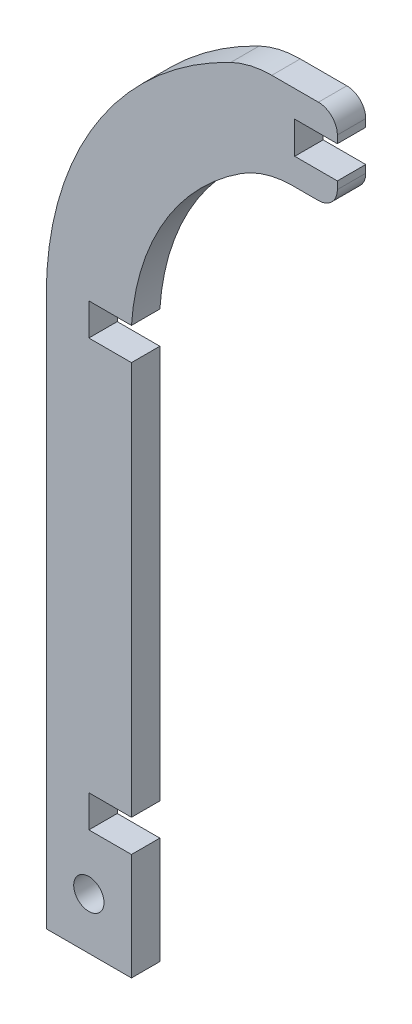
from build123d import *

# Parameters (mm, degrees)
BOSS_EXTRUDE1_DEPTH      = 1.5
M3_CLEARANCE_HOLE1_D     = 3.2
M3_CLEARANCE_HOLE1_DEPTH = 10
M3_CLEARANCE_HOLE1_TIP   = 0.96137699
FILLET1_R                = 2


with BuildPart() as part:
    # Sketch1 → Boss-Extrude1 (new, symmetric)
    with BuildSketch(Plane.XY):
        with BuildLine():
            Line((-54.5, 0), (-45.5, 0))
            Line((-45.5, 0), (-45.5, 11.3))
            Line((-45.5, 11.3), (-50, 11.3))
            Line((-50, 11.3), (-50, 14.7))
            Line((-50, 14.7), (-45.5, 14.7))
            Line((-45.5, 14.7), (-45.5, 56.3))
            Line((-45.5, 56.3), (-50, 56.3))
            Line((-50, 56.3), (-50, 59.7))
            Line((-50, 59.7), (-45.5, 59.7))
            ThreePointArc((-45.5, 59.7), (-42.033246866, 70.926263127), (-33.896614513, 79.402263071))
            ThreePointArc((-33.896614513, 79.402263071), (-31.300681808, 80.592252882), (-28.474255682, 81))
            Line((-28.474255682, 81), (-23.75, 81))
            Line((-23.75, 81), (-23.75, 83.8))
            Line((-23.75, 83.8), (-28.25, 83.8))
            Line((-28.25, 83.8), (-28.25, 87.2))
            Line((-28.25, 87.2), (-23.75, 87.2))
            Line((-23.75, 87.2), (-23.75, 90))
            Line((-23.75, 90), (-30.672661807, 90))
            ThreePointArc((-30.672661807, 90), (-32.89665693, 89.749556179), (-35.009254886, 89.010769138))
            ThreePointArc((-35.009254886, 89.010769138), (-49.222697481, 76.313635273), (-54.5, 58))
            Line((-54.5, 58), (-54.5, 0))
        make_face()
    extrude(amount=BOSS_EXTRUDE1_DEPTH, both=True)

    # M3 Clearance Hole1
    with Locations(Plane.XY.offset(1.5)):
        with Locations((-50, 5.4375)):
            Hole(M3_CLEARANCE_HOLE1_D / 2, depth=M3_CLEARANCE_HOLE1_DEPTH)
            with Locations((0, 0, -(M3_CLEARANCE_HOLE1_DEPTH + M3_CLEARANCE_HOLE1_TIP / 2))):  # 118° drill point
                Cone(0, M3_CLEARANCE_HOLE1_D / 2, M3_CLEARANCE_HOLE1_TIP, mode=Mode.SUBTRACT)

    # Fillet1
    fillet1_edges = [part.edges().sort_by_distance(p)[0] for p in [
        (-23.75, 90, 0),
        (-23.75, 81, 0),
    ]]
    fillet(fillet1_edges, radius=FILLET1_R)


solid = part.part
